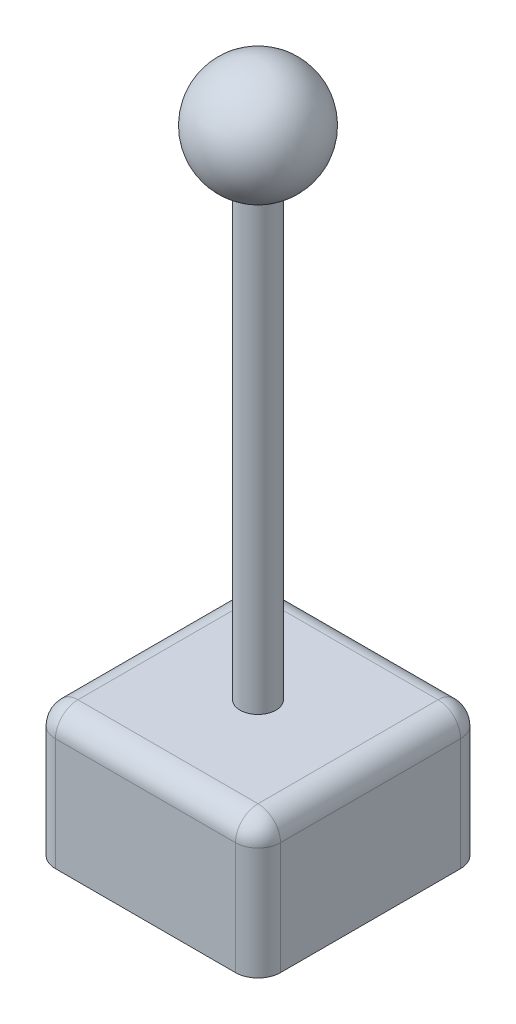
from build123d import *

# Parameters (mm, degrees)
SKETCH_1_W      = 50
SKETCH_1_H      = 50
EXTRUDE_1_DEPTH = 30
FILLET_1_R      = 5
SKETCH_2_R      = 4
EXTRUDE_2_DEPTH = 100


with BuildPart() as part:
    # 草图1 → 凸台-拉伸1 (new body)
    with BuildSketch(Plane(origin=(0, 0, 0), x_dir=(1, 0, 0), z_dir=(0, 1, 0))):
        Rectangle(SKETCH_1_W, SKETCH_1_H)
    extrude(amount=EXTRUDE_1_DEPTH)

    # 圆角1
    fillet_1_edges = [part.edges().sort_by_distance(p)[0] for p in [
        (25, 30, 0),
        (0, 30, -25),
        (-25, 30, 0),
        (-25, 15, -25),
        (25, 15, -25),
        (25, 15, 25),
        (-25, 15, 25),
        (0, 30, 25),
    ]]
    fillet(fillet_1_edges, radius=FILLET_1_R)

    # 草图2 → 凸台-拉伸2 (add)
    with BuildSketch(Plane(origin=(0, 30, 0), x_dir=(1, 0, 0), z_dir=(0, 1, 0))):
        with Locations(Location((0, 0, 0), (0, 0, 270))):
            Circle(SKETCH_2_R)
    extrude(amount=EXTRUDE_2_DEPTH)

    # 草图3 → 旋转1 (revolve)
    with BuildSketch(Plane.XY):
        with BuildLine():
            Line((0, 130), (0, 128))
            ThreePointArc((0, 128), (12.5, 140.5), (0, 153))
            Line((0, 153), (0, 130))
        make_face()
    revolve(axis=Axis((0, 130, 0), (0, 1, 0)))


solid = part.part
